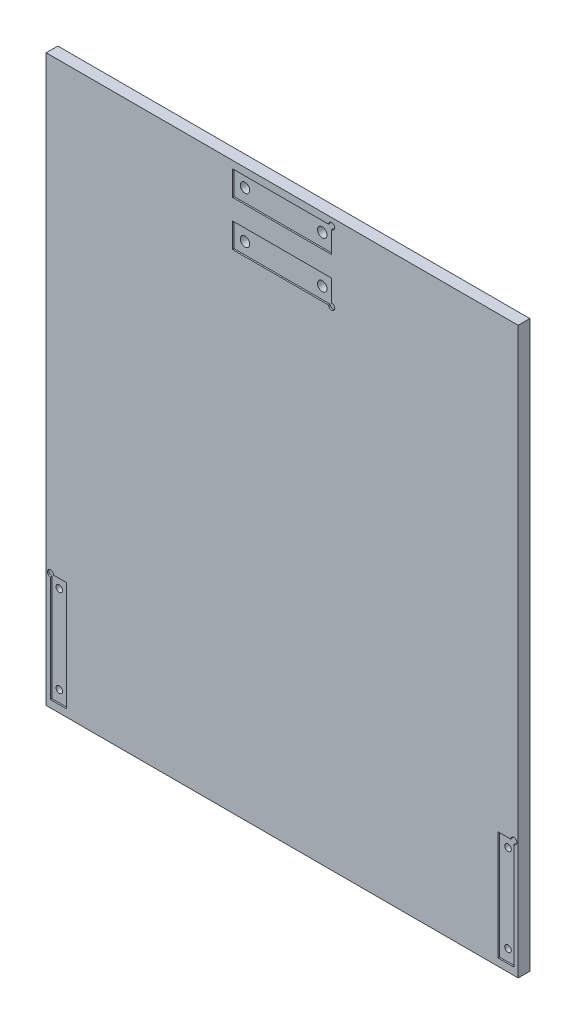
from build123d import *

# Parameters (mm, degrees)
ESQUISSE1_W             = 324
ESQUISSE1_H             = 388
BOSS_EXTRU_1_DEPTH      = 8
ENL_V_MAT_EXTRU_1_DEPTH = 1
ESQUISSE3_R             = 2.25
ENL_V_MAT_EXTRU_2_DEPTH = 253.841847802
ENL_V_MAT_EXTRU_3_DEPTH = 1
ESQUISSE5_R             = 3.25
ENL_V_MAT_EXTRU_4_DEPTH = 253.841847802


with BuildPart() as part:
    # Esquisse1 → Boss.-Extru.1 (new body)
    with BuildSketch(Plane.XY):
        Rectangle(ESQUISSE1_W, ESQUISSE1_H)
    extrude(amount=BOSS_EXTRU_1_DEPTH)

    # Esquisse2 → Enlèv. mat.-Extru.1 (cut)
    with BuildSketch(Plane.XY.offset(8)):
        with BuildLine():
            Line((148, -114), (156.9, -114))
            ThreePointArc((156.9, -114), (160.48492424, -112.51507576), (159, -116.1))
            Line((159, -116.1), (159, -189))
            Line((159, -189), (148, -189))
            Line((148, -189), (148, -114))
        make_face()
    enl_v_mat_extru_1 = extrude(amount=-ENL_V_MAT_EXTRU_1_DEPTH, mode=Mode.SUBTRACT)

    # Symétrie1: Enlèv. mat.-Extru.1 across plane
    add(enl_v_mat_extru_1.mirror(Plane(origin=(0, 0, 0), x_dir=(0, 0, 1), z_dir=(1, 0, 0))), mode=Mode.SUBTRACT)

    # Esquisse3 → Enlèv. mat.-Extru.2 (cut, through all)
    with BuildSketch(Plane.XY.offset(7)):
        with Locations((154, -121)):
            Circle(ESQUISSE3_R)
        with Locations(Location((154, -181, 0), (0, 0, 180))):
            Circle(ESQUISSE3_R)
    enl_v_mat_extru_2 = extrude(amount=-ENL_V_MAT_EXTRU_2_DEPTH, mode=Mode.SUBTRACT)

    # Symétrie2: Enlèv. mat.-Extru.2 across plane
    add(enl_v_mat_extru_2.mirror(Plane(origin=(0, 0, 0), x_dir=(0, 0, 1), z_dir=(1, 0, 0))), mode=Mode.SUBTRACT)

    # Esquisse4 → Enlèv. mat.-Extru.3 (cut)
    with BuildSketch(Plane.XY.offset(8)):
        with BuildLine():
            Line((-34, 189), (31.9, 189))
            ThreePointArc((31.9, 189), (35.48492424, 190.48492424), (34, 186.9))
            Line((34, 186.9), (34, 172))
            Line((34, 172), (-34, 172))
            Line((-34, 172), (-34, 189))
        make_face()
        with BuildLine():
            Line((34, 143.1), (34, 158))
            Line((34, 158), (-34, 158))
            Line((-34, 158), (-34, 141))
            Line((-34, 141), (31.9, 141))
            ThreePointArc((31.9, 141), (35.48492424, 139.51507576), (34, 143.1))
        make_face()
    extrude(amount=-ENL_V_MAT_EXTRU_3_DEPTH, mode=Mode.SUBTRACT)

    # Esquisse5 → Enlèv. mat.-Extru.4 (cut, through all)
    with BuildSketch(Plane.XY.offset(7)):
        with Locations((-26.5, 181)):
            Circle(ESQUISSE5_R)
        with Locations(Location((26.5, 181, 0), (0, 0, 180))):
            Circle(ESQUISSE5_R)
        with Locations((26.5, 149)):
            Circle(ESQUISSE5_R)
        with Locations(Location((-26.5, 149, 0), (0, 0, 180))):
            Circle(ESQUISSE5_R)
    extrude(amount=-ENL_V_MAT_EXTRU_4_DEPTH, mode=Mode.SUBTRACT)


solid = part.part
